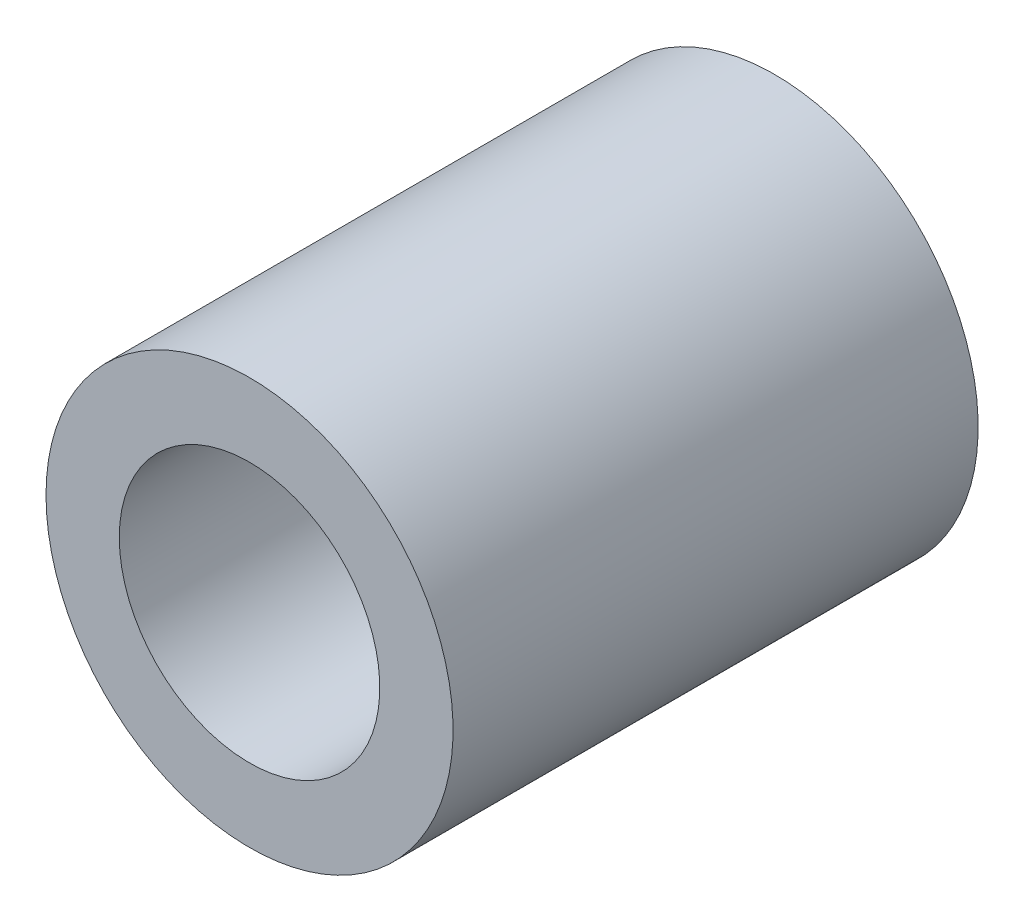
from build123d import *

# Parameters (mm, degrees)
SKETCH1_R           = 2.5
SKETCH1_R_2         = 1.6
BOSS_EXTRUDE1_DEPTH = 6.45


with BuildPart() as part:
    # Sketch1 → Boss-Extrude1 (new body)
    with BuildSketch(Plane.XY):
        with Locations(Location((0, 0, 0), (0, 0, 180))):
            Circle(SKETCH1_R)
        with Locations(Location((0, 0, 0), (0, 0, 180))):
            Circle(SKETCH1_R_2, mode=Mode.SUBTRACT)
    extrude(amount=BOSS_EXTRUDE1_DEPTH)


solid = part.part
